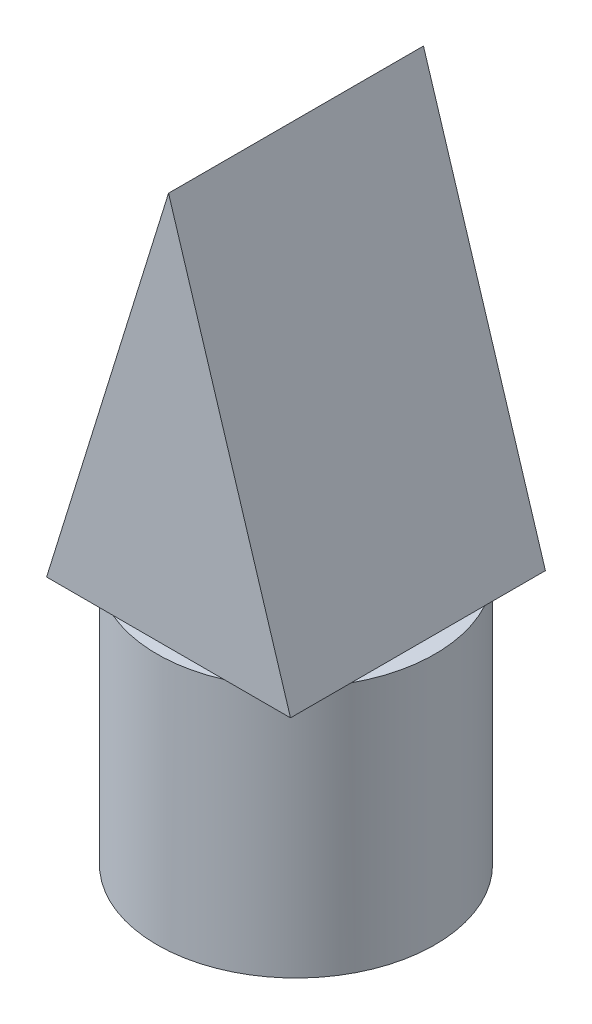
from build123d import *

# Parameters (mm, degrees)
SKETCH1_R           = 5.3
SKETCH1_R_2         = 3.5
BOSS_EXTRUDE1_DEPTH = 9.6
BOSS_EXTRUDE2_DEPTH = 4.86


with BuildPart() as part:
    # Sketch1 → Boss-Extrude1 (new body)
    with BuildSketch(Plane(origin=(0, 0, 0), x_dir=(1, 0, 0), z_dir=(0, 1, 0))):
        with Locations(Location((0, 0, 0), (0, 0, 270))):
            Circle(SKETCH1_R)
        with Locations(Location((0, 0, 0), (0, 0, 270))):
            Circle(SKETCH1_R_2, mode=Mode.SUBTRACT)
    extrude(amount=BOSS_EXTRUDE1_DEPTH)

    # Sketch2 → Boss-Extrude2 (add, symmetric)
    with BuildSketch(Plane.XY):
        Polygon((-4.65, 9.6), (4.65, 9.6), (0, 24.6), align=None)
    extrude(amount=BOSS_EXTRUDE2_DEPTH, both=True)


solid = part.part
